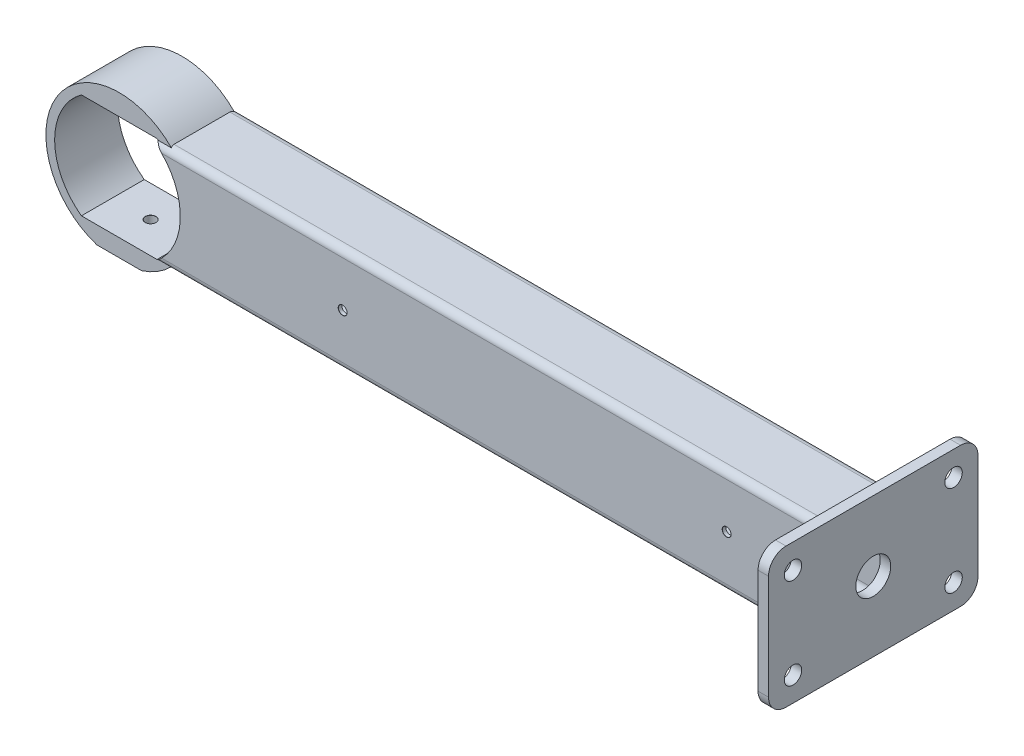
from build123d import *

# Parameters (mm, degrees)
BOSS_EXTRUDE1_DEPTH             = 207
SKETCH9_W                       = 60.00000000000001
SKETCH9_H                       = 40.00000000000001
SKETCH9_R                       = 5.000000000000005
SKETCH9_R_2                     = 2.5000000000000018
BOSS_EXTRUDE2_DEPTH             = 3
BOSS_EXTRUDE3_DEPTH             = 9
BOSS_EXTRUDE3_DEPTH_BACK        = 9
SKETCH10_R                      = 21
CUT_EXTRUDE1_DEPTH              = 19
CUT_EXTRUDE1_DEPTH_BACK         = 19
F_3_0MM_DOWEL_HOLE1_D           = 3
F_3_0MM_DOWEL_HOLE1_DEPTH       = 7.5
F_3_0MM_DOWEL_HOLE1_CSINK_D     = 3.05
F_3_0MM_DOWEL_HOLE1_CSINK_ANGLE = 90
F_3_0MM_DOWEL_HOLE1_TIP         = 0.9012909285413404
FILLET1_R                       = 5
SKETCH13_W                      = 19.825171117808697
SKETCH13_H                      = 19.67209798719679
CUT_EXTRUDE2_DEPTH              = 10
F_2_5MM_DOWEL_HOLE1_D           = 2.5
F_2_5MM_DOWEL_HOLE1_CSINK_D     = 2.55
F_2_5MM_DOWEL_HOLE1_CSINK_ANGLE = 90


with BuildPart() as part:
    # Sketch2 → Boss-Extrude1 (new body)
    with BuildSketch(Plane(origin=(0, 0, 0), x_dir=(0, 0, -1), z_dir=(1, 0, 0))):
        with BuildLine():
            Line((-7.999999999999989, 15), (7.999999999999983, 15))
            ThreePointArc((7.999999999999983, 15), (9.414213562373092, 14.414213562373094), (9.999999999999996, 12.999999999999986))
            Line((9.999999999999996, 12.999999999999986), (10, -12.999999999999986))
            ThreePointArc((10, -12.999999999999986), (9.414213562373096, -14.414213562373094), (7.999999999999987, -15))
            Line((7.999999999999987, -15), (-7.999999999999987, -15))
            ThreePointArc((-7.999999999999987, -15), (-9.414213562373096, -14.414213562373094), (-10, -12.999999999999986))
            Line((-10, -12.999999999999986), (-10.000000000000004, 12.999999999999986))
            ThreePointArc((-10.000000000000004, 12.999999999999986), (-9.4142135623731, 14.414213562373096), (-7.999999999999989, 15))
        make_face()
        with BuildLine():
            Line((-6.999999999999988, 13.999999999999996), (6.999999999999982, 13.999999999999996))
            ThreePointArc((6.999999999999982, 13.999999999999996), (8.41421356237309, 13.41421356237309), (8.999999999999996, 11.999999999999982))
            Line((8.999999999999996, 11.999999999999982), (9.000000000000002, -11.999999999999988))
            ThreePointArc((9.000000000000002, -11.999999999999988), (8.414213562373096, -13.414213562373098), (6.999999999999987, -14.000000000000002))
            Line((6.999999999999987, -14.000000000000002), (-6.999999999999984, -14.000000000000002))
            ThreePointArc((-6.999999999999984, -14.000000000000002), (-8.414213562373092, -13.414213562373096), (-8.999999999999998, -11.999999999999988))
            Line((-8.999999999999998, -11.999999999999988), (-9.000000000000004, 11.999999999999982))
            ThreePointArc((-9.000000000000004, 11.999999999999982), (-8.4142135623731, 13.414213562373092), (-6.999999999999988, 13.999999999999996))
        make_face(mode=Mode.SUBTRACT)
    extrude(amount=BOSS_EXTRUDE1_DEPTH)

    # Sketch9 → Boss-Extrude2 (add)
    with BuildSketch(Plane(origin=(207, 0, 0), x_dir=(0, 0, -1), z_dir=(1, 0, 0))):
        Rectangle(SKETCH9_W, SKETCH9_H)
        Circle(SKETCH9_R, mode=Mode.SUBTRACT)
        with Locations((-22.999999999999996, -13)):
            Circle(SKETCH9_R_2, mode=Mode.SUBTRACT)
        with Locations((-23, 13)):
            Circle(SKETCH9_R_2, mode=Mode.SUBTRACT)
        with Locations((22.999999999999996, -13)):
            Circle(SKETCH9_R_2, mode=Mode.SUBTRACT)
        with Locations((23, 13)):
            Circle(SKETCH9_R_2, mode=Mode.SUBTRACT)
    extrude(amount=-BOSS_EXTRUDE2_DEPTH)

    # Sketch10 → Boss-Extrude3 (add, two sides: drawn at the far end of the back side and taken through both)
    with BuildSketch(Plane.XY.offset(-BOSS_EXTRUDE3_DEPTH_BACK)):
        Circle(SKETCH10_R)
        with BuildLine():
            Line((10.828203913853855, -15.000000000000002), (-10.828203913853855, -15.000000000000002))
            ThreePointArc((-10.828203913853852, -15.000000000000005), (-18.5, -5.95e-15), (-10.828203913853862, 14.999999999999996))
            Line((-10.82820391385386, 14.999999999999996), (10.82820391385386, 14.999999999999996))
            ThreePointArc((10.828203913853862, 14.999999999999998), (18.5, -3.55e-15), (10.828203913853855, -15.000000000000002))
        make_face(mode=Mode.SUBTRACT)
    extrude(amount=BOSS_EXTRUDE3_DEPTH + BOSS_EXTRUDE3_DEPTH_BACK)

    # Sketch10<3> → Cut-Extrude1 (cut, two sides: drawn at the far end of the back side and taken through both)
    with BuildSketch(Plane.XY.offset(-CUT_EXTRUDE1_DEPTH_BACK)):
        with BuildLine():
            Line((-10.828203913853855, -15.000000000000002), (10.828203913853855, -15.000000000000002))
            ThreePointArc((10.828203913853848, -15.000000000000009), (16.47075851936237, -8.42402004964684), (18.5, -4.53e-15))
            ThreePointArc((18.5, 0), (16.470758519362374, 8.424020049646831), (10.828203913853859, 14.999999999999998))
            Line((10.82820391385386, 14.999999999999996), (-10.82820391385386, 14.999999999999996))
            ThreePointArc((-10.828203913853862, 14.999999999999996), (-18.5, -5.95e-15), (-10.828203913853852, -15.000000000000005))
        make_face()
    extrude(amount=CUT_EXTRUDE1_DEPTH + CUT_EXTRUDE1_DEPTH_BACK, mode=Mode.SUBTRACT)

    # Ø3.0mm Dowel Hole1
    with Locations(Plane(origin=(0, -15.000000000000002, 0), x_dir=(1, 0, 0), z_dir=(0, 1, 0))):
        with Locations((0, 0)):
            CounterSinkHole(F_3_0MM_DOWEL_HOLE1_D / 2, F_3_0MM_DOWEL_HOLE1_CSINK_D / 2, depth=F_3_0MM_DOWEL_HOLE1_DEPTH, counter_sink_angle=F_3_0MM_DOWEL_HOLE1_CSINK_ANGLE)
            with Locations((0, 0, -(F_3_0MM_DOWEL_HOLE1_DEPTH + F_3_0MM_DOWEL_HOLE1_TIP / 2))):  # 118° drill point
                Cone(0, F_3_0MM_DOWEL_HOLE1_D / 2, F_3_0MM_DOWEL_HOLE1_TIP, mode=Mode.SUBTRACT)

    # Fillet1
    fillet1_edges = [part.edges().sort_by_distance(p)[0] for p in [
        (205.5, 20.000000000000004, 30),
        (205.5, -20.000000000000004, 30),
        (205.5, -20.000000000000004, -30),
        (205.5, 20.000000000000004, -30),
    ]]
    fillet(fillet1_edges, radius=FILLET1_R)

    # Sketch13 → Cut-Extrude2 (cut)
    with BuildSketch(Plane(origin=(0, -20, 0), x_dir=(1, 0, 0), z_dir=(0, 1, 0))):
        Rectangle(SKETCH13_W, SKETCH13_H)
    extrude(amount=-CUT_EXTRUDE2_DEPTH, mode=Mode.SUBTRACT)

    # Ø2.5mm Dowel Hole1 (through all)
    with Locations(Plane.XY.offset(10.000000000000002)):
        with Locations((65, 0), (175, 0)):
            CounterSinkHole(F_2_5MM_DOWEL_HOLE1_D / 2, F_2_5MM_DOWEL_HOLE1_CSINK_D / 2, counter_sink_angle=F_2_5MM_DOWEL_HOLE1_CSINK_ANGLE)


solid = part.part
